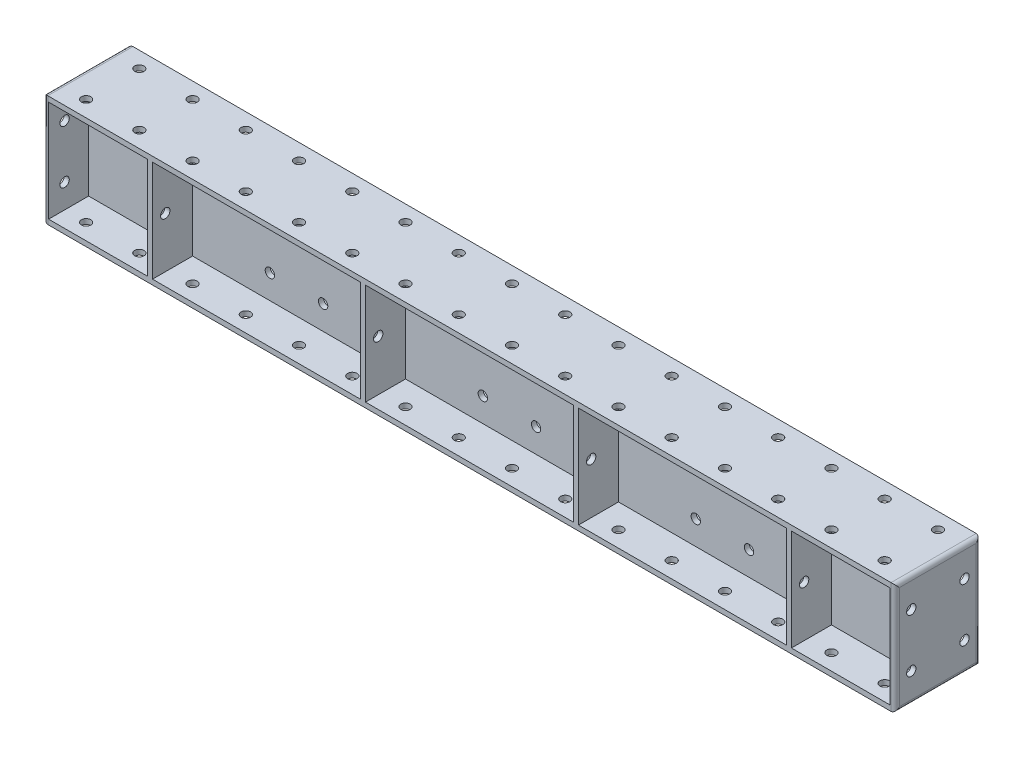
from build123d import *

# Parameters (mm, degrees)
SKETCH_1_W                        = 2000
SKETCH_1_H                        = 262
EXTRUDE_1_DEPTH                   = 200
SKETCH_5_W                        = 232
SKETCH_5_H                        = 238
SKETCH_5_W_2                      = 488
CUT_EXTRUDE_10_DEPTH              = 2027.979032945
SKETCH_7_W                        = 2000
SKETCH_7_H                        = 12
EXTRUDE_13_DEPTH                  = 260
SKETCH_8_R                        = 11
CUT_EXTRUDE_14_DEPTH              = 2027.979032945
PATTERN_LINEAR_3_COUNT            = 16
PATTERN_LINEAR_3_PITCH            = 125
PATTERN_LINEAR_3_COUNT_DIR2       = 2
PATTERN_LINEAR_3_PITCH_DIR2       = 125
SKETCH_10_R                       = 11
CUT_EXTRUDE_16_DEPTH              = 20
PATTERN_LINEAR_5_COUNT            = 2
PATTERN_LINEAR_5_PITCH            = 125
PATTERN_LINEAR_5_COUNT_DIR2       = 2
PATTERN_LINEAR_5_PITCH_DIR2       = 125
CUT_EXTRUDE_START                 = -20
SKETCH_11_R                       = 11
CUT_EXTRUDE_17_DEPTH              = 20
PATTERN_LINEAR_6_COUNT            = 2
PATTERN_LINEAR_6_PITCH            = 125
PATTERN_LINEAR_6_COUNT_DIR2       = 2
PATTERN_LINEAR_6_PITCH_DIR2       = 125
SKETCH_12_R                       = 11
CUT_EXTRUDE_18_DEPTH              = 1550
PATTERN_LINEAR_8_COUNT            = 2
PATTERN_LINEAR_8_PITCH            = 140.2426687
FILLET_1_R                        = 10
FILLET_2_R                        = 10
SKETCH_13_R                       = 11
CUT_EXTRUDE_19_DEPTH              = 2020.871283028
PATTERN_LINEAR_9_COUNT            = 2
PATTERN_LINEAR_9_PITCH            = 125
PATTERN_LINEAR_9_COUNT_DIR2       = 2
PATTERN_LINEAR_9_PITCH_DIR2       = 125
PATTERN_LINEAR_10_COUNT           = 3
PATTERN_LINEAR_10_PITCH           = 500
PATTERN_LINEAR_10_COPY_1_SKETCH_R = 11
PATTERN_LINEAR_10_COPY_1_DEPTH    = 2020.871283028
PATTERN_LINEAR_10_COPY_2_SKETCH_R = 11
PATTERN_LINEAR_10_COPY_2_DEPTH    = 2020.871283028
PATTERN_LINEAR_10_COPY_3_SKETCH_R = 11
PATTERN_LINEAR_10_COPY_3_DEPTH    = 2020.871283028
PATTERN_LINEAR_10_COPY_4_SKETCH_R = 11
PATTERN_LINEAR_10_COPY_4_DEPTH    = 2020.871283028
PATTERN_LINEAR_10_COPY_5_SKETCH_R = 11
PATTERN_LINEAR_10_COPY_5_DEPTH    = 2020.871283028
PATTERN_LINEAR_10_COPY_6_SKETCH_R = 11
PATTERN_LINEAR_10_COPY_6_DEPTH    = 2020.871283028


with BuildPart() as part:
    # 草图1 → 拉伸1 (new body)
    with BuildSketch(Plane.XY):
        with Locations((1000, 131)):
            Rectangle(SKETCH_1_W, SKETCH_1_H)
    extrude(amount=EXTRUDE_1_DEPTH)

    # 草图5 → 拉伸10 (cut, through all)
    with BuildSketch(Plane.XY.offset(200)):
        with Locations((128, 131)):
            Rectangle(SKETCH_5_W, SKETCH_5_H)
        with Locations((500, 131)):
            Rectangle(SKETCH_5_W_2, SKETCH_5_H)
        with Locations((1000, 131)):
            Rectangle(SKETCH_5_W_2, SKETCH_5_H)
        with Locations((1500, 131)):
            Rectangle(SKETCH_5_W_2, SKETCH_5_H)
        with Locations((1872, 131)):
            Rectangle(SKETCH_5_W, SKETCH_5_H)
    extrude(amount=-CUT_EXTRUDE_10_DEPTH, mode=Mode.SUBTRACT)

    # 草图7 → 拉伸13 (add)
    with BuildSketch(Plane.XZ):
        with Locations((1000, 100)):
            Rectangle(SKETCH_7_W, SKETCH_7_H)
    extrude(amount=-EXTRUDE_13_DEPTH)

    # 草图8 → 拉伸14 (cut, through all)
    with BuildSketch(Plane.XZ):
        with Locations(Location((62.5, 37.5, 0), (0, 0, 270))):
            Circle(SKETCH_8_R)
    cut_extrude_14 = extrude(amount=-CUT_EXTRUDE_14_DEPTH, mode=Mode.SUBTRACT)

    # 阵列(线性)3: Cut-Extrude 14 16 × 2
    with Locations(*[(i * PATTERN_LINEAR_3_PITCH, 0, j * PATTERN_LINEAR_3_PITCH_DIR2) for i in range(PATTERN_LINEAR_3_COUNT) for j in range(PATTERN_LINEAR_3_COUNT_DIR2) if (i, j) != (0, 0)]):
        add(cut_extrude_14, mode=Mode.SUBTRACT)

    # 草图10 → 拉伸16 (cut)
    with BuildSketch(Plane.ZY):
        with Locations((37.5, 68.5)):
            Circle(SKETCH_10_R)
    cut_extrude_16 = extrude(amount=-CUT_EXTRUDE_16_DEPTH, mode=Mode.SUBTRACT)

    # 阵列(线性)5: Cut-Extrude 16 2 × 2
    with Locations(*[(0, j * PATTERN_LINEAR_5_PITCH_DIR2, i * PATTERN_LINEAR_5_PITCH) for i in range(PATTERN_LINEAR_5_COUNT) for j in range(PATTERN_LINEAR_5_COUNT_DIR2) if (i, j) != (0, 0)]):
        add(cut_extrude_16, mode=Mode.SUBTRACT)

    # 草图11 → 拉伸17 (cut)
    with BuildSketch(Plane(origin=(2000, 0, 0), x_dir=(0, 0, -1), z_dir=(1, 0, 0)).offset(CUT_EXTRUDE_START)):
        with Locations(Location((-162.5, 68.5, 0), (0, 0, 180))):
            Circle(SKETCH_11_R)
    cut_extrude_17 = extrude(amount=CUT_EXTRUDE_17_DEPTH, mode=Mode.SUBTRACT)

    # 阵列(线性)6: Cut-Extrude 17 2 × 2
    with Locations(*[(0, j * PATTERN_LINEAR_6_PITCH_DIR2, -i * PATTERN_LINEAR_6_PITCH) for i in range(PATTERN_LINEAR_6_COUNT) for j in range(PATTERN_LINEAR_6_COUNT_DIR2) if (i, j) != (0, 0)]):
        add(cut_extrude_17, mode=Mode.SUBTRACT)

    # 草图12 → 拉伸18 (cut)
    with BuildSketch(Plane(origin=(1756, 0, 0), x_dir=(0, 0, -1), z_dir=(1, 0, 0))):
        with Locations((-170.12133435, 131)):
            Circle(SKETCH_12_R)
    cut_extrude_18 = extrude(amount=-CUT_EXTRUDE_18_DEPTH, mode=Mode.SUBTRACT)

    # 阵列(线性)8: 拉伸18 ×2
    with Locations(*[(0, 0, -i * PATTERN_LINEAR_8_PITCH) for i in range(1, PATTERN_LINEAR_8_COUNT)]):
        add(cut_extrude_18, mode=Mode.SUBTRACT)

    # 圆角1
    fillet_1_edges = [part.edges().sort_by_distance(p)[0] for p in [
        (0, 131, 200),
        (0, 131, 0),
        (0, 262, 100),
        (0, 0, 100),
    ]]
    fillet(fillet_1_edges, radius=FILLET_1_R)

    # 圆角2
    fillet_2_edges = [part.edges().sort_by_distance(p)[0] for p in [
        (2000, 131, 200),
        (2000, 131, 0),
        (2000, 262, 100),
        (2000, 0, 100),
    ]]
    fillet(fillet_2_edges, radius=FILLET_2_R)

    # 草图13 → 拉伸19 (cut, through all)
    with BuildSketch(Plane.XY.offset(106)):
        with Locations((437.5, 68.5)):
            Circle(SKETCH_13_R)
    cut_extrude_19 = extrude(amount=-CUT_EXTRUDE_19_DEPTH, mode=Mode.SUBTRACT)

    # 阵列(线性)9: Cut-Extrude 19 2 × 2
    with Locations(*[(i * PATTERN_LINEAR_9_PITCH, j * PATTERN_LINEAR_9_PITCH_DIR2, 0) for i in range(PATTERN_LINEAR_9_COUNT) for j in range(PATTERN_LINEAR_9_COUNT_DIR2) if (i, j) != (0, 0)]):
        add(cut_extrude_19, mode=Mode.SUBTRACT)

    # 阵列(线性)10: 拉伸19 ×3
    with Locations(*[(i * PATTERN_LINEAR_10_PITCH, 0, 0) for i in range(1, PATTERN_LINEAR_10_COUNT)]):
        add(cut_extrude_19, mode=Mode.SUBTRACT)

    # 阵列(线性)10 copy 1 sketch → 阵列(线性)10 copy 1 (cut, through all)
    with BuildSketch(Plane(origin=(500, 125, 106), x_dir=(1, 0, 0), z_dir=(0, 0, 1))):
        with Locations((437.5, 68.5)):
            Circle(PATTERN_LINEAR_10_COPY_1_SKETCH_R)
    extrude(amount=-PATTERN_LINEAR_10_COPY_1_DEPTH, mode=Mode.SUBTRACT)

    # 阵列(线性)10 copy 2 sketch → 阵列(线性)10 copy 2 (cut, through all)
    with BuildSketch(Plane(origin=(1000, 125, 106), x_dir=(1, 0, 0), z_dir=(0, 0, 1))):
        with Locations((437.5, 68.5)):
            Circle(PATTERN_LINEAR_10_COPY_2_SKETCH_R)
    extrude(amount=-PATTERN_LINEAR_10_COPY_2_DEPTH, mode=Mode.SUBTRACT)

    # 阵列(线性)10 copy 3 sketch → 阵列(线性)10 copy 3 (cut, through all)
    with BuildSketch(Plane(origin=(625, 0, 106), x_dir=(1, 0, 0), z_dir=(0, 0, 1))):
        with Locations((437.5, 68.5)):
            Circle(PATTERN_LINEAR_10_COPY_3_SKETCH_R)
    extrude(amount=-PATTERN_LINEAR_10_COPY_3_DEPTH, mode=Mode.SUBTRACT)

    # 阵列(线性)10 copy 4 sketch → 阵列(线性)10 copy 4 (cut, through all)
    with BuildSketch(Plane(origin=(1125, 0, 106), x_dir=(1, 0, 0), z_dir=(0, 0, 1))):
        with Locations((437.5, 68.5)):
            Circle(PATTERN_LINEAR_10_COPY_4_SKETCH_R)
    extrude(amount=-PATTERN_LINEAR_10_COPY_4_DEPTH, mode=Mode.SUBTRACT)

    # 阵列(线性)10 copy 5 sketch → 阵列(线性)10 copy 5 (cut, through all)
    with BuildSketch(Plane(origin=(625, 125, 106), x_dir=(1, 0, 0), z_dir=(0, 0, 1))):
        with Locations((437.5, 68.5)):
            Circle(PATTERN_LINEAR_10_COPY_5_SKETCH_R)
    extrude(amount=-PATTERN_LINEAR_10_COPY_5_DEPTH, mode=Mode.SUBTRACT)

    # 阵列(线性)10 copy 6 sketch → 阵列(线性)10 copy 6 (cut, through all)
    with BuildSketch(Plane(origin=(1125, 125, 106), x_dir=(1, 0, 0), z_dir=(0, 0, 1))):
        with Locations((437.5, 68.5)):
            Circle(PATTERN_LINEAR_10_COPY_6_SKETCH_R)
    extrude(amount=-PATTERN_LINEAR_10_COPY_6_DEPTH, mode=Mode.SUBTRACT)


solid = part.part
